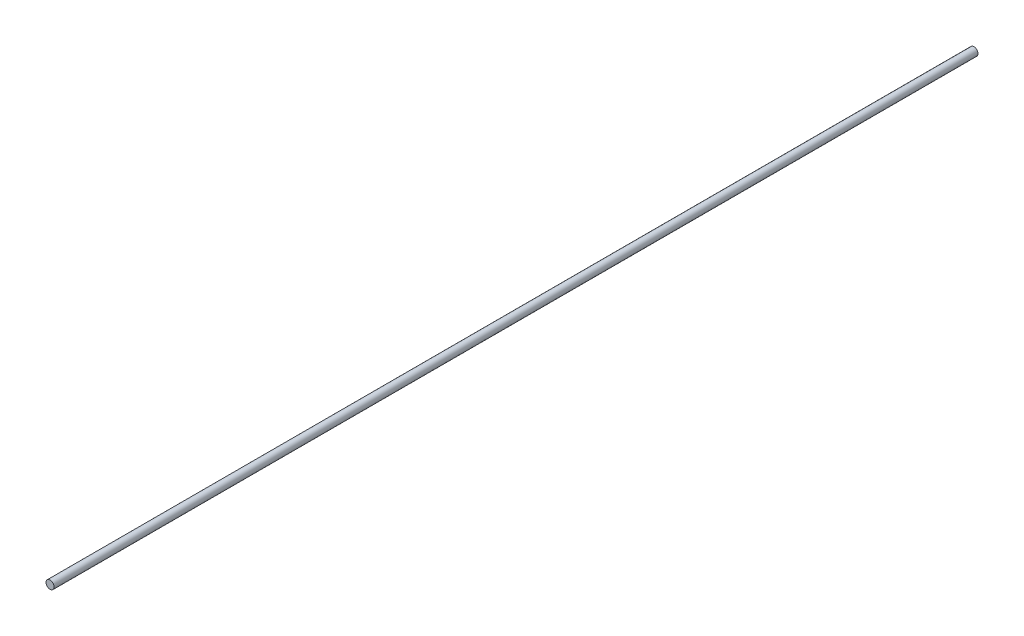
from build123d import *

# Parameters (mm, degrees)
BOSS_EXTRUDE1_DEPTH      = 457.2
BOSS_EXTRUDE1_DEPTH_BACK = 457.2
SKETCH3_R                = 4


with BuildPart() as part:
    # Sketch3 → Boss-Extrude1 (new, two sides: drawn at the far end of the back side and taken through both)
    with BuildSketch(Plane.XY.offset(-BOSS_EXTRUDE1_DEPTH_BACK)):
        with Locations(Location((0, 0, 0), (0, 0, 180))):
            Circle(SKETCH3_R)
    extrude(amount=BOSS_EXTRUDE1_DEPTH + BOSS_EXTRUDE1_DEPTH_BACK)


solid = part.part
